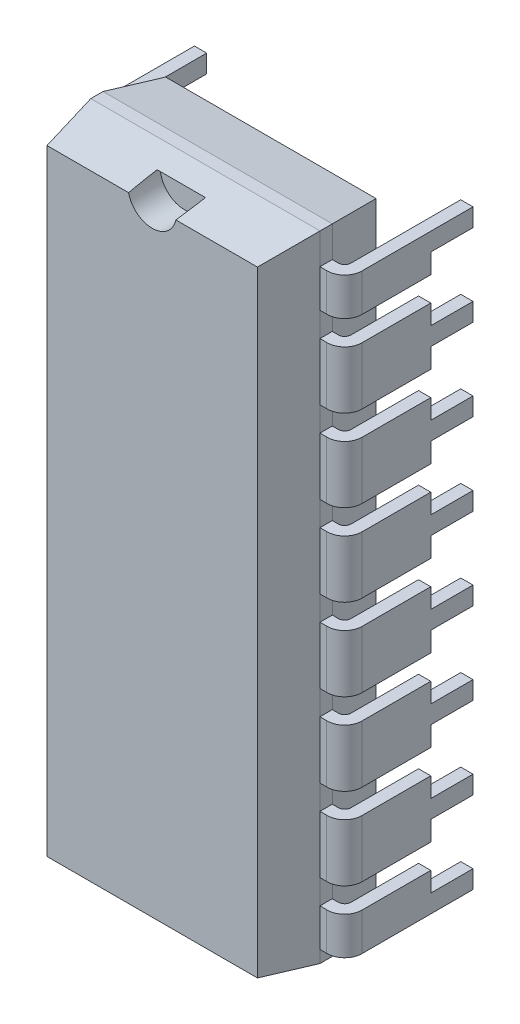
from build123d import *
from OCP.BRepFilletAPI import BRepFilletAPI_MakeChamfer

# Parameters (mm, degrees)
SKETCH_2_W          = 7.11
SKETCH_2_H          = 19.68
EXTRUDE_1_DEPTH     = 3.68
CHAMFER_1_SIZE      = 1.65
CHAMFER_1_SIZE2     = 0.290939518
SKETCH_1_W          = 0.38
SKETCH_1_H          = 1.17
SKETCH_1_H_2        = 1.78
SKETCH_4_W          = 0.38
SKETCH_4_H          = 1.17
SKETCH_4_H_2        = 1.78
CUT_EXTRUDE_1_DEPTH = 1
SKETCH_7_W          = 0.38
SKETCH_7_H          = 0.56
EXTRUDE_2_DEPTH     = 3.81
SKETCH_8_R          = 0.08664064
CUT_EXTRUDE_2_DEPTH = 3.5
SKETCH_9_W          = 12.537105982
SKETCH_9_H          = 22.686191776
CUT_EXTRUDE_3_DEPTH = 2.5


with BuildPart() as part:
    # Эскиз2 → Вытянуть1 (new body)
    with BuildSketch(Plane.XY.offset(4.32)):
        with Locations((4.13, -8.6)):
            Rectangle(SKETCH_2_W, SKETCH_2_H)
    extrude(amount=-EXTRUDE_1_DEPTH)

    # Фаска1: one chamfer whose edges measure the first distance from different faces: ONE call of the kernel's chamfer builder (chamfer() names one face for all edges)
    chamfer_1_edges_1 = [part.edges().sort_by_distance(p)[0] for p in [
        (7.685, -8.6, 0.64),
        (7.685, -8.6, 4.32),
    ]]
    chamfer_1_side_1 = [part.faces().sort_by_distance(p)[0] for p in [
        (7.685, -8.6, 2.48),
    ]]
    chamfer_1_edges_2 = [part.edges().sort_by_distance(p)[0] for p in [
        (4.13, 1.24, 0.64),
        (4.13, 1.24, 4.32),
    ]]
    chamfer_1_side_2 = [part.faces().sort_by_distance(p)[0] for p in [
        (4.13, 1.24, 2.48),
    ]]
    chamfer_1_edges_3 = [part.edges().sort_by_distance(p)[0] for p in [
        (0.575, -8.6, 0.64),
        (0.575, -8.6, 4.32),
    ]]
    chamfer_1_side_3 = [part.faces().sort_by_distance(p)[0] for p in [
        (0.575, -8.6, 2.48),
    ]]
    chamfer_1_edges_4 = [part.edges().sort_by_distance(p)[0] for p in [
        (4.13, -18.44, 4.32),
        (4.13, -18.44, 0.64),
    ]]
    chamfer_1_side_4 = [part.faces().sort_by_distance(p)[0] for p in [
        (4.13, -18.44, 2.48),
    ]]
    chamfer_1 = BRepFilletAPI_MakeChamfer(part.part.solid().wrapped)
    for e in chamfer_1_edges_1:
        chamfer_1.Add(CHAMFER_1_SIZE, CHAMFER_1_SIZE2, e.wrapped, chamfer_1_side_1[0].wrapped)  # the first distance lies on this face
    for e in chamfer_1_edges_2:
        chamfer_1.Add(CHAMFER_1_SIZE, CHAMFER_1_SIZE2, e.wrapped, chamfer_1_side_2[0].wrapped)  # the first distance lies on this face
    for e in chamfer_1_edges_3:
        chamfer_1.Add(CHAMFER_1_SIZE, CHAMFER_1_SIZE2, e.wrapped, chamfer_1_side_3[0].wrapped)  # the first distance lies on this face
    for e in chamfer_1_edges_4:
        chamfer_1.Add(CHAMFER_1_SIZE, CHAMFER_1_SIZE2, e.wrapped, chamfer_1_side_4[0].wrapped)  # the first distance lies on this face
    add(Compound.cast(chamfer_1.Shape()), mode=Mode.REPLACE)

    # По траектории3: sweep along a path in Эскиз3
    with BuildLine(Plane(origin=(0, 0, 0), x_dir=(1, 0, 0), z_dir=(0, 1, 0))) as sweep_3_path:
        Line((0, 0), (0, -2.133259053))
        ThreePointArc((0, -2.133259053), (0.110742929, -2.388711698), (0.372891736, -2.482509634))
        Line((0.372891736, -2.482509634), (4.132679514, -2.482509634))
        Line((4.132679514, -2.482509634), (7.887108264, -2.482509634))
        ThreePointArc((7.887108264, -2.482509634), (8.149257071, -2.388711698), (8.26, -2.133259053))
        Line((8.26, -2.133259053), (8.26, 0))
    # Эскиз1 → По траектории3 (sweep)
    with BuildSketch(Plane.XY):
        with Locations((0, -0.305)):
            Rectangle(SKETCH_1_W, SKETCH_1_H)
        with Locations((0, -2.54)):
            Rectangle(SKETCH_1_W, SKETCH_1_H_2)
        with Locations((0, -5.08)):
            Rectangle(SKETCH_1_W, SKETCH_1_H_2)
        with Locations((0, -7.62)):
            Rectangle(SKETCH_1_W, SKETCH_1_H_2)
        with Locations((0, -10.16)):
            Rectangle(SKETCH_1_W, SKETCH_1_H_2)
        with Locations((0, -12.7)):
            Rectangle(SKETCH_1_W, SKETCH_1_H_2)
        with Locations((0, -15.24)):
            Rectangle(SKETCH_1_W, SKETCH_1_H_2)
        with Locations((0, -17.475)):
            Rectangle(SKETCH_1_W, SKETCH_1_H)
    sweep(path=sweep_3_path.line, transition=Transition.RIGHT)

    # По траектории4: sweep along a path in Эскиз5
    with BuildLine(Plane(origin=(0, 0, 0), x_dir=(1, 0, 0), z_dir=(0, 1, 0))) as sweep_4_path:
        Line((7.685, -2.48), (7.873732591, -2.48))
        ThreePointArc((7.873732591, -2.48), (8.146864964, -2.366864826), (8.26, -2.093732395))
        Line((8.26, -2.093732395), (8.26, 0))
    # Эскиз4 → По траектории4 (sweep)
    with BuildSketch(Plane.XY):
        with Locations((8.26, -0.305)):
            Rectangle(SKETCH_4_W, SKETCH_4_H)
        with Locations((8.26, -17.475)):
            Rectangle(SKETCH_4_W, SKETCH_4_H)
        with Locations((8.26, -2.54)):
            Rectangle(SKETCH_4_W, SKETCH_4_H_2)
        with Locations((8.26, -5.08)):
            Rectangle(SKETCH_4_W, SKETCH_4_H_2)
        with Locations((8.26, -7.62)):
            Rectangle(SKETCH_4_W, SKETCH_4_H_2)
        with Locations((8.26, -10.16)):
            Rectangle(SKETCH_4_W, SKETCH_4_H_2)
        with Locations((8.26, -12.7)):
            Rectangle(SKETCH_4_W, SKETCH_4_H_2)
        with Locations((8.26, -15.24)):
            Rectangle(SKETCH_4_W, SKETCH_4_H_2)
    sweep(path=sweep_4_path.line)

    # Эскиз6 → Вырез-Вытянуть1 (cut)
    with BuildSketch(Plane.XY.offset(4.32)):
        with BuildLine():
            Line((3.38, 1.107883832), (4.88, 1.107883832))
            ThreePointArc((4.88, 1.107883832), (4.13, 0.357883832), (3.38, 1.107883832))
        make_face()
    extrude(amount=-CUT_EXTRUDE_1_DEPTH, mode=Mode.SUBTRACT)

    # Эскиз7 → Вытянуть2 (add)
    with BuildSketch(Plane.XY):
        Rectangle(SKETCH_7_W, SKETCH_7_H)
        with Locations((0, -2.54)):
            Rectangle(SKETCH_7_W, SKETCH_7_H)
        with Locations((0, -5.08)):
            Rectangle(SKETCH_7_W, SKETCH_7_H)
        with Locations((0, -7.62)):
            Rectangle(SKETCH_7_W, SKETCH_7_H)
        with Locations((0, -10.16)):
            Rectangle(SKETCH_7_W, SKETCH_7_H)
        with Locations((0, -12.7)):
            Rectangle(SKETCH_7_W, SKETCH_7_H)
        with Locations((0, -15.24)):
            Rectangle(SKETCH_7_W, SKETCH_7_H)
        with Locations((0, -17.78)):
            Rectangle(SKETCH_7_W, SKETCH_7_H)
        with Locations((8.26, 0)):
            Rectangle(SKETCH_7_W, SKETCH_7_H)
        with Locations((8.26, -2.54)):
            Rectangle(SKETCH_7_W, SKETCH_7_H)
        with Locations((8.26, -5.08)):
            Rectangle(SKETCH_7_W, SKETCH_7_H)
        with Locations((8.26, -7.62)):
            Rectangle(SKETCH_7_W, SKETCH_7_H)
        with Locations((8.26, -10.16)):
            Rectangle(SKETCH_7_W, SKETCH_7_H)
        with Locations((8.26, -12.7)):
            Rectangle(SKETCH_7_W, SKETCH_7_H)
        with Locations((8.26, -15.24)):
            Rectangle(SKETCH_7_W, SKETCH_7_H)
        with Locations((8.26, -17.78)):
            Rectangle(SKETCH_7_W, SKETCH_7_H)
    extrude(amount=-EXTRUDE_2_DEPTH)

    # Эскиз8 → Вырез-Вытянуть2 (cut)
    with BuildSketch(Plane(origin=(0, 0, -3.81), x_dir=(-1, 0, 0), z_dir=(0, 0, -1))):
        Circle(SKETCH_8_R)
    extrude(amount=-CUT_EXTRUDE_2_DEPTH, mode=Mode.SUBTRACT)

    # Эскиз9 → Вырез-Вытянуть3 (cut)
    with BuildSketch(Plane(origin=(0, 0, -3.81), x_dir=(-1, 0, 0), z_dir=(0, 0, -1))):
        with Locations((-4.219550757, -8.226871846)):
            Rectangle(SKETCH_9_W, SKETCH_9_H)
    extrude(amount=-CUT_EXTRUDE_3_DEPTH, mode=Mode.SUBTRACT)


solid = part.part
